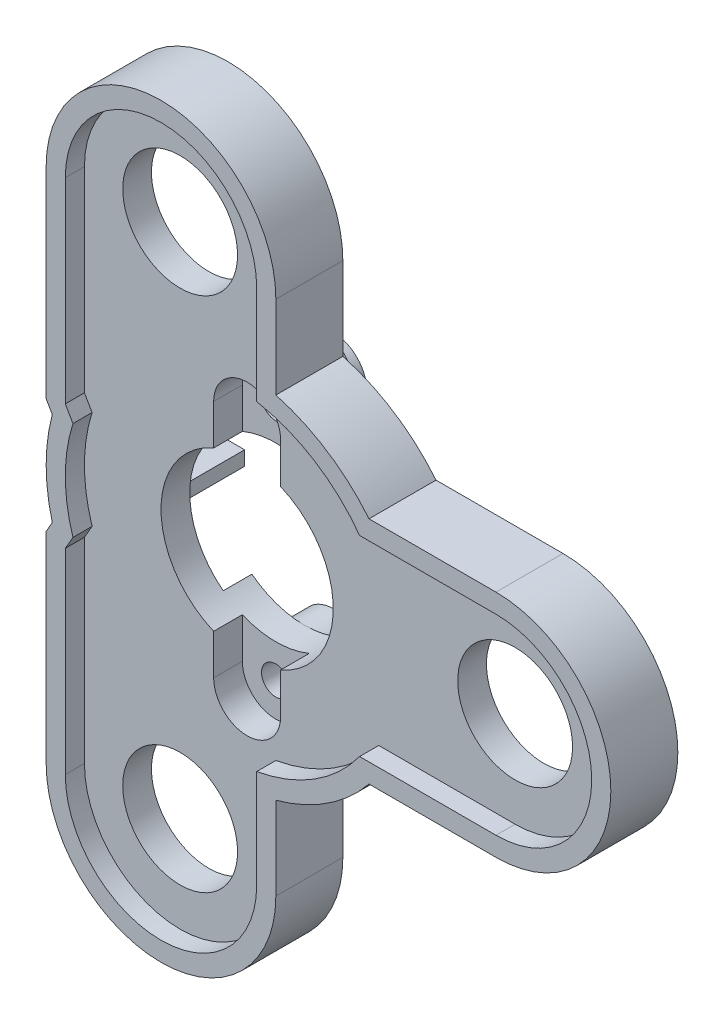
from build123d import *
from build123d.topology import SkipClean

# Parameters (mm, degrees)
ESQUISSE1_R                  = 9
ESQUISSE1_R_2                = 6
EXTRUSION1_DEPTH             = 3.5
ENL_V_MAT_EXTRU_1_DEPTH      = 2
ENL_V_START                  = -2
ESQUISSE4_R                  = 17
ENL_V_MAT_EXTRU_2_DEPTH      = 2
ESQUISSE6_W                  = 7.877170109
ESQUISSE6_H                  = 1.5
EXTRUSION4_DEPTH             = 6
R_P_TITION_CIRCULAIRE1_COUNT = 2
EXTRUSION5_START             = 3
EXTRUSION5_DEPTH             = 3
ENL_V_MAT_EXTRU_3_DEPTH      = 3
ESQUISSE10_R                 = 3.5
EXTRUSION6_DEPTH             = 3
ESQUISSE11_R                 = 1.5
ENL_V_MAT_EXTRU_4_DEPTH      = 57.938563382


with BuildPart() as part:
    # Esquisse1 → Extrusion1 (new, symmetric)
    with BuildSketch(Plane.XY):
        with BuildLine():
            Line((28, 12), (14.730919863, 12))
            ThreePointArc((14.730919863, 12), (10.360766525, 15.926534997), (5, 18.33030278))
            Line((5, 18.33030278), (5, 27))
            ThreePointArc((5, 27), (-7, 39), (-19, 27))
            Line((-19, 27), (-19, 6))
            Line((-19, 6), (-18.35969719, 4.890963001))
            ThreePointArc((-18.35969719, 4.890963001), (-19, 0), (-18.35969719, -4.890963001))
            Line((-18.35969719, -4.890963001), (-19, -6))
            Line((-19, -6), (-19, -27))
            ThreePointArc((-19, -27), (-7, -39), (5, -27))
            Line((5, -27), (5, -18.33030278))
            ThreePointArc((5, -18.33030278), (10.360766525, -15.926534997), (14.730919863, -12))
            Line((14.730919863, -12), (28, -12))
            ThreePointArc((28, -12), (40, 0), (28, 12))
        make_face()
        with Locations(Location((0, 0, 0), (0, 0, 127.669886964))):
            Circle(ESQUISSE1_R, mode=Mode.SUBTRACT)
        with Locations(Location((-7, -27, 0), (0, 0, 180))):
            Circle(ESQUISSE1_R_2, mode=Mode.SUBTRACT)
        with Locations((-7, 27)):
            Circle(ESQUISSE1_R_2, mode=Mode.SUBTRACT)
        with Locations((28, 0)):
            Circle(ESQUISSE1_R_2, mode=Mode.SUBTRACT)
    extrude(amount=EXTRUSION1_DEPTH, both=True)

    # Esquisse3 → Enlèv. mat.-Extru.1 (cut)
    with BuildSketch(Plane.XY.offset(3.5)):
        with BuildLine():
            Line((-16.200693523, -5.151458956), (-17, -6.535898385))
            Line((-17, -6.535898385), (-17, -27))
            ThreePointArc((-17, -27), (-7, -37), (3, -27))
            Line((3, -27), (3, -16.733200531))
            ThreePointArc((3, -16.733200531), (9.025274953, -14.406401772), (13.747727085, -10))
            Line((13.747727085, -10), (28, -10))
            ThreePointArc((28, -10), (38, 0), (28, 10))
            Line((28, 10), (13.747727085, 10))
            ThreePointArc((13.747727085, 10), (9.025274953, 14.406401772), (3, 16.733200531))
            Line((3, 16.733200531), (3, 27))
            ThreePointArc((3, 27), (-7, 37), (-17, 27))
            Line((-17, 27), (-17, 6.535898385))
            Line((-17, 6.535898385), (-16.200693523, 5.151458956))
            ThreePointArc((-16.200693523, 5.151458956), (-17, 0), (-16.200693523, -5.151458956))
        make_face()
    extrude(amount=-ENL_V_MAT_EXTRU_1_DEPTH, mode=Mode.SUBTRACT)

    # Esquisse4 → Enlèv. mat.-Extru.2 (cut)
    with BuildSketch(Plane(origin=(0, 0, -3.5), x_dir=(-1, 0, 0), z_dir=(0, 0, -1)).offset(ENL_V_START)):
        Circle(ESQUISSE4_R)
        with BuildLine():
            Line((17, 12), (17, 27))
            ThreePointArc((17, 27), (7, 37), (-3, 27))
            Line((-3, 27), (-3, 19.899748742))
            ThreePointArc((-3, 19.899748742), (-2.670820393, 19.158128893), (-1.9, 18.904761305))
            ThreePointArc((-1.9, 18.904761305), (7.635630986, 17.398193568), (15.2, 11.4))
            ThreePointArc((15.2, 11.4), (16.316227766, 11.051316702), (17, 12))
        make_face()
        with BuildLine():
            Line((-17.860571099, 10), (-28, 10))
            ThreePointArc((-28, 10), (-38, 0), (-28, -10))
            Line((-28, -10), (-17.860571099, -10))
            ThreePointArc((-17.860571099, -10), (-17.009101781, -9.524404424), (-16.967542545, -8.55))
            ThreePointArc((-16.967542545, -8.55), (-19, 0), (-16.967542545, 8.55))
            ThreePointArc((-16.967542545, 8.55), (-17.009101781, 9.524404424), (-17.860571099, 10))
        make_face()
        with BuildLine():
            Line((-3, -19.899748742), (-3, -27))
            ThreePointArc((-3, -27), (7, -37), (17, -27))
            Line((17, -27), (17, -12))
            ThreePointArc((17, -12), (16.316227766, -11.051316702), (15.2, -11.4))
            ThreePointArc((15.2, -11.4), (7.635630986, -17.398193568), (-1.9, -18.904761305))
            ThreePointArc((-1.9, -18.904761305), (-2.670820393, -19.158128893), (-3, -19.899748742))
        make_face()
    extrude(amount=ENL_V_MAT_EXTRU_2_DEPTH, mode=Mode.SUBTRACT)

    # Esquisse6 → Extrusion4 (add)
    with BuildSketch(Plane(origin=(0, 0, -1.5), x_dir=(-1, 0, 0), z_dir=(0, 0, -1))):
        with Locations((13.200835764, 0)):
            Rectangle(ESQUISSE6_W, ESQUISSE6_H)
    extrusion4 = extrude(amount=EXTRUSION4_DEPTH)

    # Répétition circulaire1: Extrusion4 ×2 about axis
    r_p_tition_circulaire1_axis = Axis((0, 0, 0), (0, 0, 1))
    for i in range(1, R_P_TITION_CIRCULAIRE1_COUNT):
        add(extrusion4.rotate(r_p_tition_circulaire1_axis, i * 360 / R_P_TITION_CIRCULAIRE1_COUNT))

    # Esquisse7 → Extrusion5 (add)
    with SkipClean():  # the faces are left unmerged after this step: merging them gives an invalid solid
        with BuildSketch(Plane(origin=(0, 0, -1.5), x_dir=(-1, 0, 0), z_dir=(0, 0, -1)).offset(EXTRUSION5_START)):
            with BuildLine():
                Line((5.5, 14), (5.5, 7.123903424))
                ThreePointArc((5.5, 7.123903424), (0, 9), (-5.5, 7.123903424))
                Line((-5.5, 7.123903424), (-5.5, 14))
                ThreePointArc((-5.5, 14), (0, 19.5), (5.5, 14))
            make_face()
            with BuildLine():
                Line((-5.5, -14), (-5.5, -7.123903424))
                ThreePointArc((-5.5, -7.123903424), (0, -9), (5.5, -7.123903424))
                Line((5.5, -7.123903424), (5.5, -14))
                ThreePointArc((5.5, -14), (0, -19.5), (-5.5, -14))
            make_face()
        extrude(amount=-EXTRUSION5_DEPTH)

    # Esquisse8 → Enlèv. mat.-Extru.3 (cut)
    with SkipClean():  # the faces are left unmerged after this step: merging them gives an invalid solid
        with BuildSketch(Plane.XY.offset(1.5)):
            with BuildLine():
                Line((3.5, 12.5), (3.5, -12.5))
                ThreePointArc((3.5, -12.5), (0, -16), (-3.5, -12.5))
                Line((-3.5, -12.5), (-3.5, 12.5))
                ThreePointArc((-3.5, 12.5), (0, 16), (3.5, 12.5))
            make_face()
        extrude(amount=-ENL_V_MAT_EXTRU_3_DEPTH, mode=Mode.SUBTRACT)

    # Esquisse10 → Extrusion6 (add)
    with SkipClean():  # the faces are left unmerged after this step: merging them gives an invalid solid
        with BuildSketch(Plane(origin=(0, 0, -4.5), x_dir=(-1, 0, 0), z_dir=(0, 0, -1))):
            with Locations(Location((0, 12.5, 0), (0, 0, 270))):
                Circle(ESQUISSE10_R)
            with Locations(Location((0, -12.5, 0), (0, 0, 89.999632483))):
                Circle(ESQUISSE10_R)
        extrude(amount=EXTRUSION6_DEPTH)

    # Esquisse11 → Enlèv. mat.-Extru.4 (cut, through all)
    with SkipClean():  # the faces are left unmerged after this step: merging them gives an invalid solid
        with BuildSketch(Plane(origin=(0, 0, -7.5), x_dir=(-1, 0, 0), z_dir=(0, 0, -1))):
            with Locations((0, -12.5)):
                Circle(ESQUISSE11_R)
            with Locations((0, 12.5)):
                Circle(ESQUISSE11_R)
        extrude(amount=-ENL_V_MAT_EXTRU_4_DEPTH, mode=Mode.SUBTRACT)


solid = part.part
